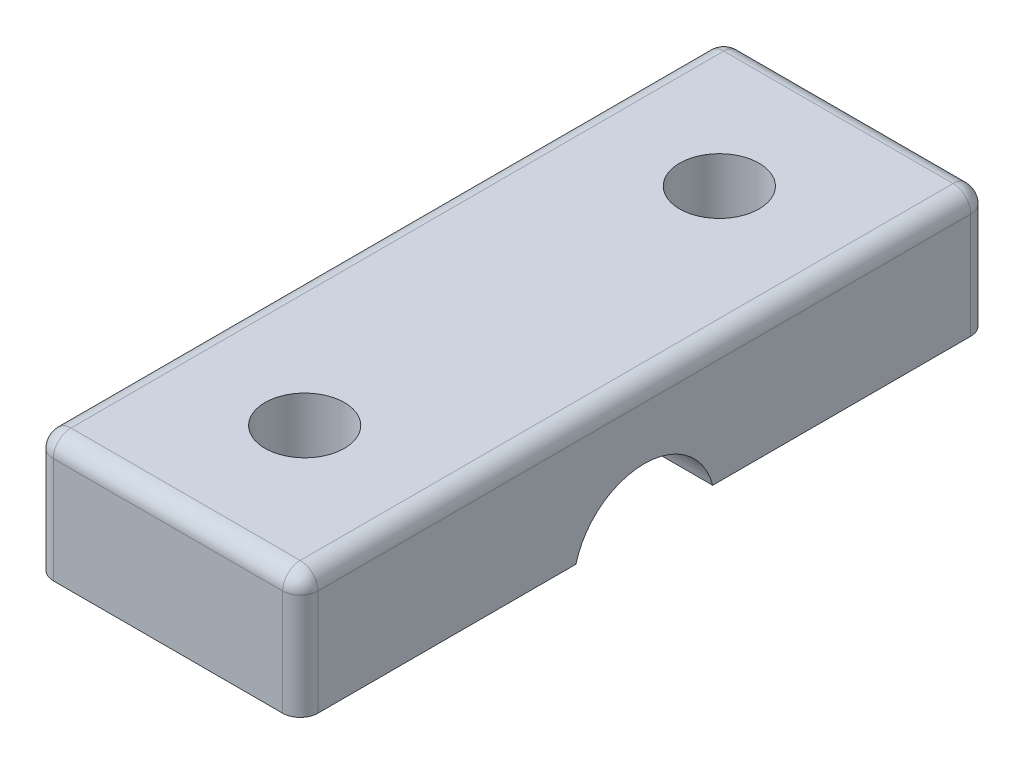
from build123d import *

# Parameters (mm, degrees)
SKETCH1_W           = 15
SKETCH1_H           = 39
SKETCH1_R           = 2.25
BOSS_EXTRUDE1_DEPTH = 8
FILLET2_R           = 1
CUT_EXTRUDE1_REACH  = 44.544


with BuildPart() as part:
    # Sketch1 → Boss-Extrude1 (new body)
    with BuildSketch(Plane(origin=(0, 0, 0), x_dir=(1, 0, 0), z_dir=(0, 1, 0))):
        with Locations((7.5, 19.5)):
            Rectangle(SKETCH1_W, SKETCH1_H)
        with Locations(Location((7.5, 31.25, 0), (0, 0, 270))):
            Circle(SKETCH1_R, mode=Mode.SUBTRACT)
        with Locations(Location((7.5, 7.75, 0), (0, 0, 90))):
            Circle(SKETCH1_R, mode=Mode.SUBTRACT)
    extrude(amount=BOSS_EXTRUDE1_DEPTH)

    # Fillet2
    fillet2_edges = [part.edges().sort_by_distance(p)[0] for p in [
        (15, 8, -19.5),
        (7.5, 8, -39),
        (0, 8, -19.5),
        (7.5, 8, 0),
        (0, 4, -39),
        (15, 4, -39),
        (15, 4, 0),
        (0, 4, 0),
    ]]
    fillet(fillet2_edges, radius=FILLET2_R)

    # Cut-Extrude1: up to this face of the body (flat: up to its plane)
    cut_extrude1_end = Plane(part.part.faces().sort_by_distance((15, 3.5, -19.5))[0])
    # Sketch2 → Cut-Extrude1 (cut, up to the picked face)
    with BuildSketch(Plane.ZY, mode=Mode.PRIVATE) as cut_extrude1_sk1:
        with BuildLine():
            Line((-23.372983346, 1), (-45.302397196, 1))
            Line((-45.302397196, 1), (-45.302397196, -1))
            Line((-45.302397196, -1), (4.697602804, -1))
            Line((4.697602804, -1), (4.697602804, 1))
            Line((4.697602804, 1), (-15.627016654, 1))
            ThreePointArc((-15.627016654, 1), (-19.5, 4), (-23.372983346, 1))
        make_face()
    cut_extrude1_tool1 = split(extrude(cut_extrude1_sk1.sketch, amount=-CUT_EXTRUDE1_REACH, mode=Mode.PRIVATE), bisect_by=cut_extrude1_end, keep=Keep.BOTH, mode=Mode.PRIVATE)
    add(cut_extrude1_tool1.solids().sort_by(Axis((0, 0.330412, -20.184541), (1, 0, 0)))[0], mode=Mode.SUBTRACT)


solid = part.part
